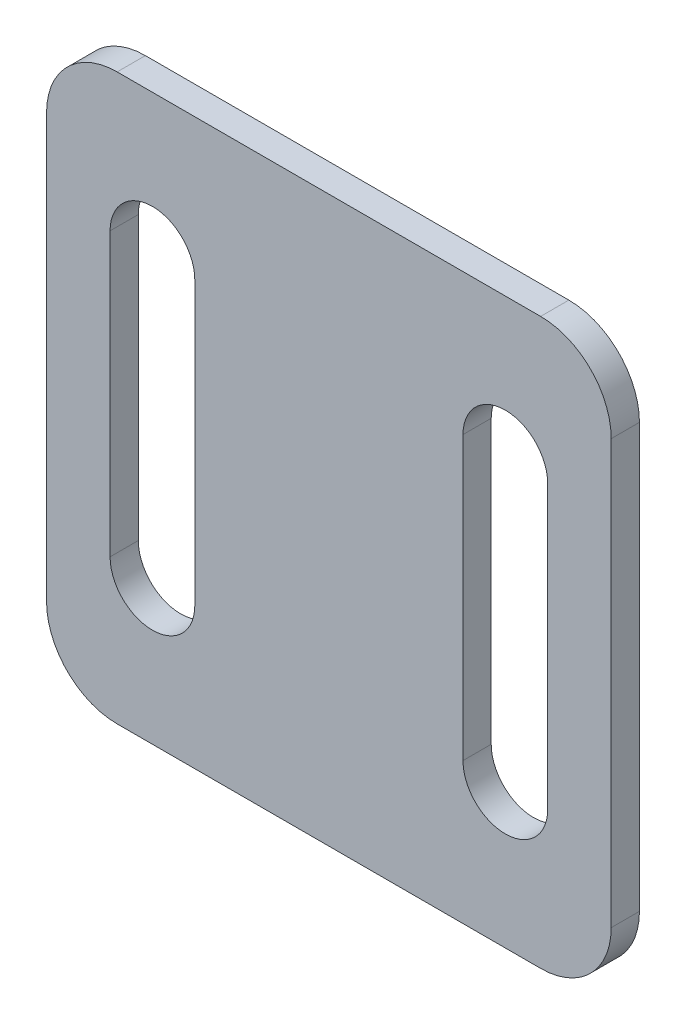
from build123d import *

# Parameters (mm, degrees)
SKETCH_1_W      = 80
SKETCH_1_H      = 80
EXTRUDE_1_DEPTH = 4
FILLET_1_R      = 10


with BuildPart() as part:
    # Эскиз1 → Бобышка-Вытянуть1 (new body)
    with BuildSketch(Plane.XY):
        Rectangle(SKETCH_1_W, SKETCH_1_H)
        with BuildLine():
            Line((19, -20), (19, 20))
            ThreePointArc((19, 20), (25, 26), (31, 20))
            Line((31, 20), (31, -20))
            ThreePointArc((31, -20), (25, -26), (19, -20))
        make_face(mode=Mode.SUBTRACT)
        with BuildLine():
            Line((-31, -20), (-31, 20))
            ThreePointArc((-31, 20), (-25, 26), (-19, 20))
            Line((-19, 20), (-19, -20))
            ThreePointArc((-19, -20), (-25, -26), (-31, -20))
        make_face(mode=Mode.SUBTRACT)
    extrude(amount=EXTRUDE_1_DEPTH)

    # Скругление1
    fillet_1_edges = [part.edges().sort_by_distance(p)[0] for p in [
        (40, -40, 2),
        (-40, -40, 2),
        (-40, 40, 2),
        (40, 40, 2),
    ]]
    fillet(fillet_1_edges, radius=FILLET_1_R)


solid = part.part
